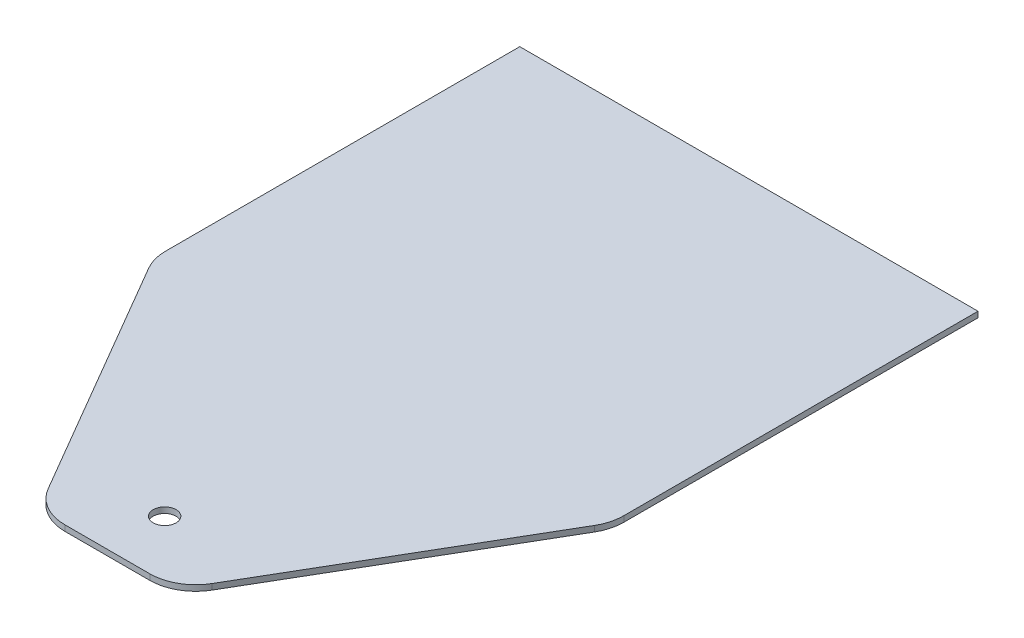
from build123d import *

# Parameters (mm, degrees)
BOSS_EXTRUDE1_DEPTH = 0.79375
FILLET1_R           = 12.7
CUT_EXTRUDE1_REACH  = 190.806
SKETCH2_R           = 3.175


with BuildPart() as part:
    # Sketch1 → Boss-Extrude1 (new, symmetric)
    with BuildSketch(Plane(origin=(0, 0, 0), x_dir=(1, 0, 0), z_dir=(0, 1, 0))):
        Polygon((-63.5, 0), (63.5, 0), (63.5, -101.6), (19.05, -177.8), (-19.05, -177.8), (-63.5, -101.6), align=None)
    extrude(amount=BOSS_EXTRUDE1_DEPTH, both=True)

    # Fillet1
    fillet1_edges = [part.edges().sort_by_distance(p)[0] for p in [
        (19.05, 0, 177.8),
        (-19.05, 0, 177.8),
        (-63.5, 0, 101.6),
        (63.5, 0, 101.6),
    ]]
    fillet(fillet1_edges, radius=FILLET1_R)

    # Sketch2 → Cut-Extrude1 (cut, up to next)
    with BuildSketch(Plane(origin=(0, 0.79375, 0), x_dir=(1, 0, 0), z_dir=(0, 1, 0)), mode=Mode.PRIVATE) as cut_extrude1_sk1:
        with Locations(Location((0, -161.925, 0), (0, 0, 270))):
            Circle(SKETCH2_R)
    cut_extrude1_tool1 = extrude(cut_extrude1_sk1.sketch, amount=-CUT_EXTRUDE1_REACH, mode=Mode.PRIVATE) & part.part
    add(cut_extrude1_tool1.solids().sort_by_distance((0, 0.79375, 161.925))[0], mode=Mode.SUBTRACT)


solid = part.part
